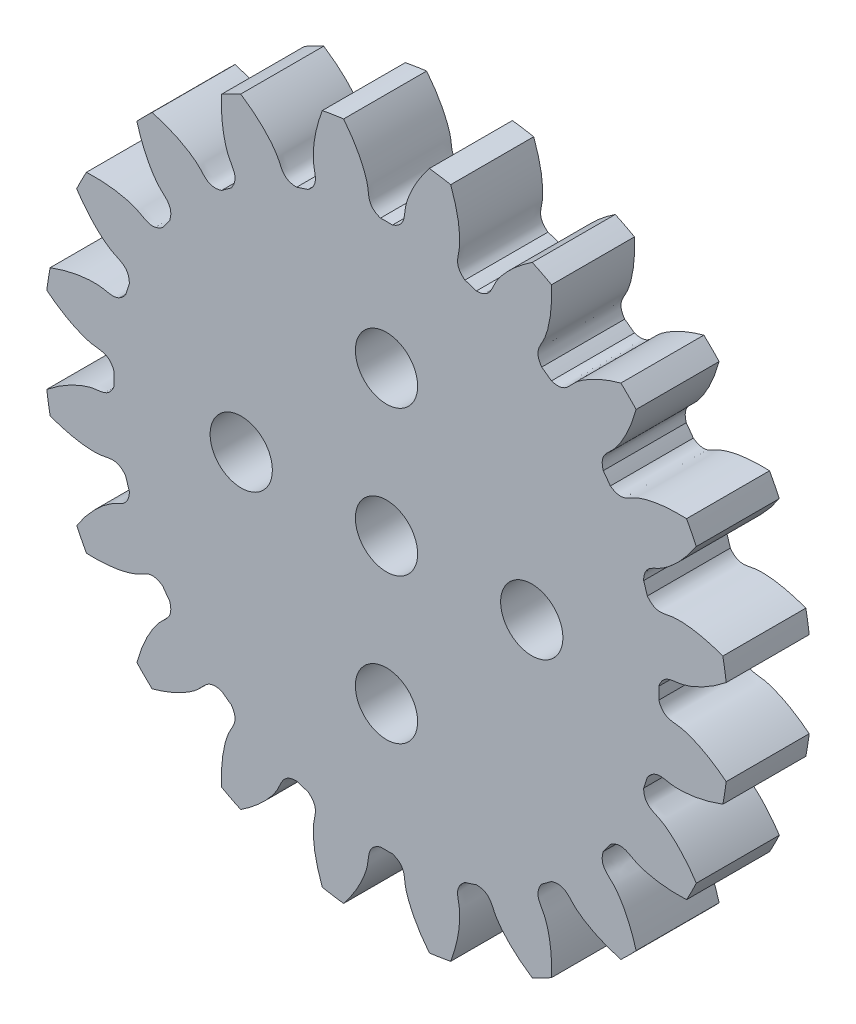
from build123d import *

# Parameters (mm, degrees)
SKETCH_1_R               = 16.5
EXTRUDE_1_DEPTH          = 4
CUT_EXTRUDE_1_DEPTH      = 24.674881204
PATTERN_CIRCULAR_1_COUNT = 20
SKETCH_4_R               = 1.5
CUT_EXTRUDE_2_DEPTH      = 10


with BuildPart() as part:
    # 草图1 → 凸台-拉伸1 (new body)
    with BuildSketch(Plane.XY):
        Circle(SKETCH_1_R)
    extrude(amount=EXTRUDE_1_DEPTH)

    # 草图2 → 切除-拉伸1 (cut, through all)
    with BuildSketch(Plane.XY):
        with BuildLine():
            ThreePointArc((0.289974901, 13.121796354), (0, 13.125), (-0.289974901, 13.121796354))
            add(Edge.make_bspline(
                [(-0.289974901, 13.121796354), (-0.916784107, 13.340213268), (-0.835626149, 13.780670548), (-0.919345585, 14.205014104), (-0.928338279, 14.246334921), (-0.939466335, 14.292951923), (-0.952938145, 14.344795254), (-0.96896871, 14.401787245), (-0.987768083, 14.463844242), (-1.009544807, 14.5308761), (-1.034504625, 14.602786421), (-1.06285065, 14.679472568), (-1.094783098, 14.760825751), (-1.130499153, 14.846731096), (-1.170192797, 14.937067727), (-1.214054647, 15.031708847), (-1.2622718, 15.130521826), (-1.315027675, 15.233368292), (-1.372501858, 15.340104225), (-1.434869948, 15.450580056), (-1.502303414, 15.564640771), (-1.574969439, 15.682126017), (-1.653030782, 15.802870208), (-1.736645634, 15.926702646), (-1.825967477, 16.05344763), (-1.921144951, 16.182924586), (-2.022321721, 16.314948181), (-2.129636342, 16.449328459), (-2.24322214, 16.585870967), (-2.363207078, 16.724376892), (-2.489713645, 16.864643194), (-2.622858733, 17.006462752), (-2.762753527, 17.149624504), (-2.909503389, 17.29391359), (-3.06320776, 17.439111509), (-3.223960048, 17.584996263), (-3.391847534, 17.731342516), (-3.566951278, 17.877921749), (-3.749346018, 18.024502419), (-3.939100102, 18.170850122), (-4.136275349, 18.31672776), (-4.412210386, 18.512459802), (-4.625898619, 18.654498902), (-4.771736973, 18.747377789)],
                knots=[0, 0, 0, 0, 0.165916003, 0.170905922, 0.176663519, 0.183188797, 0.190481754, 0.198542391, 0.207370708, 0.216966704, 0.22733038, 0.238461736, 0.250360771, 0.263027487, 0.276461881, 0.290663956, 0.30563371, 0.321371144, 0.337876258, 0.355149051, 0.373189524, 0.391997677, 0.411573509, 0.431917021, 0.453028213, 0.474907084, 0.497553636, 0.520967867, 0.545149777, 0.570099367, 0.595816637, 0.622301587, 0.649554216, 0.677574526, 0.706362514, 0.735918183, 0.766241531, 0.797332559, 0.829191267, 0.861817654, 0.895211721, 0.929373468, 1, 1, 1, 1], degree=3))
            ThreePointArc((-4.771736973, 18.747377789), (0, 19.345119481), (4.771736973, 18.747377789))
            add(Edge.make_bspline(
                [(0.289974901, 13.121796354), (0.916784107, 13.340213268), (0.835626149, 13.780670548), (0.919345585, 14.205014104), (0.928338279, 14.246334921), (0.939466335, 14.292951923), (0.952938145, 14.344795254), (0.96896871, 14.401787245), (0.987768083, 14.463844242), (1.009544807, 14.5308761), (1.034504625, 14.602786421), (1.06285065, 14.679472568), (1.094783098, 14.760825751), (1.130499153, 14.846731096), (1.170192797, 14.937067727), (1.214054647, 15.031708847), (1.2622718, 15.130521826), (1.315027675, 15.233368292), (1.372501858, 15.340104225), (1.434869948, 15.450580056), (1.502303414, 15.564640771), (1.574969439, 15.682126017), (1.653030782, 15.802870208), (1.736645634, 15.926702646), (1.825967477, 16.05344763), (1.921144951, 16.182924586), (2.022321721, 16.314948181), (2.129636342, 16.449328459), (2.24322214, 16.585870967), (2.363207078, 16.724376892), (2.489713645, 16.864643194), (2.622858733, 17.006462752), (2.762753527, 17.149624504), (2.909503389, 17.29391359), (3.06320776, 17.439111509), (3.223960048, 17.584996263), (3.391847534, 17.731342516), (3.566951278, 17.877921749), (3.749346018, 18.024502419), (3.939100102, 18.170850122), (4.136275349, 18.31672776), (4.412210386, 18.512459802), (4.625898619, 18.654498902), (4.771736973, 18.747377789)],
                knots=[0, 0, 0, 0, 0.165916003, 0.170905922, 0.176663519, 0.183188797, 0.190481754, 0.198542391, 0.207370708, 0.216966704, 0.22733038, 0.238461736, 0.250360771, 0.263027487, 0.276461881, 0.290663956, 0.30563371, 0.321371144, 0.337876258, 0.355149051, 0.373189524, 0.391997677, 0.411573509, 0.431917021, 0.453028213, 0.474907084, 0.497553636, 0.520967867, 0.545149777, 0.570099367, 0.595816637, 0.622301587, 0.649554216, 0.677574526, 0.706362514, 0.735918183, 0.766241531, 0.797332559, 0.829191267, 0.861817654, 0.895211721, 0.929373468, 1, 1, 1, 1], degree=3))
        make_face()
    cut_extrude_1 = extrude(amount=CUT_EXTRUDE_1_DEPTH, mode=Mode.SUBTRACT)

    # 阵列(圆周)1: 切除-拉伸1 ×20 about axis
    pattern_circular_1_axis = Axis((0, 0, -1.5), (0, 0, 1))
    for i in range(1, PATTERN_CIRCULAR_1_COUNT):
        add(cut_extrude_1.rotate(pattern_circular_1_axis, i * 360 / PATTERN_CIRCULAR_1_COUNT), mode=Mode.SUBTRACT)

    # 草图4 → 切除-拉伸2 (cut)
    with BuildSketch(Plane.XY.offset(4)):
        with Locations((0, 7)):
            Circle(SKETCH_4_R)
        Circle(SKETCH_4_R)
        with Locations((7, 0)):
            Circle(SKETCH_4_R)
        with Locations((0, -7)):
            Circle(SKETCH_4_R)
        with Locations((-7, 0)):
            Circle(SKETCH_4_R)
    extrude(amount=-CUT_EXTRUDE_2_DEPTH, mode=Mode.SUBTRACT)


solid = part.part
